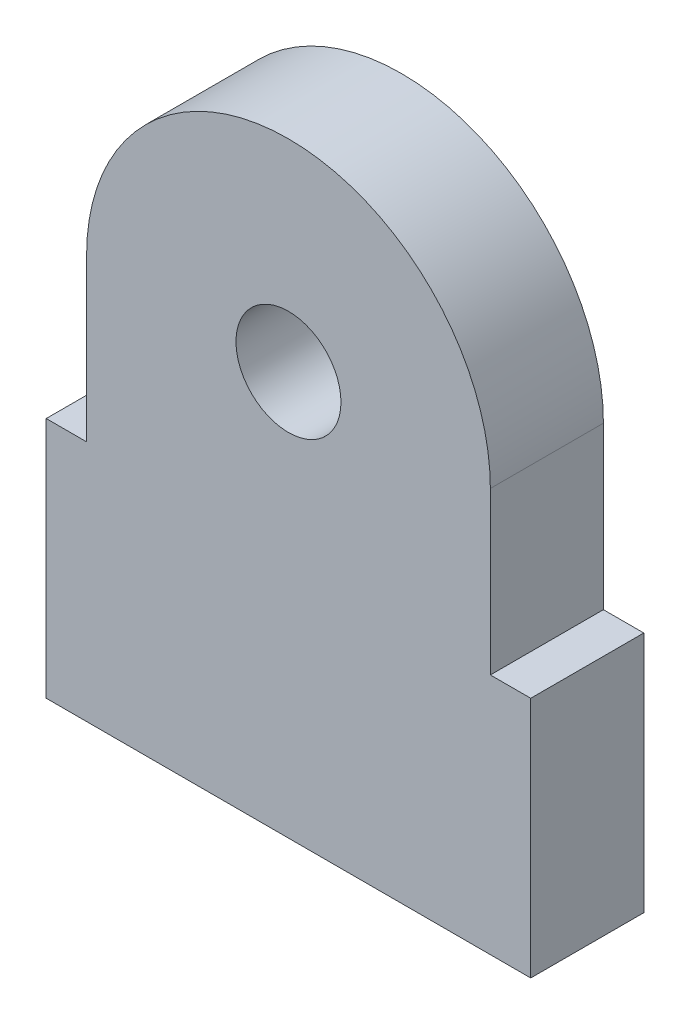
from build123d import *

# Parameters (mm, degrees)
Y_KSEKLIK_EKSTR_ZYON1_DEPTH = 7
IZIM4_R                     = 3.25
KES_EKSTR_ZYON1_DEPTH       = 30.983328701


with BuildPart() as part:
    # Çizim1 → Yükseklik-Ekstrüzyon1 (new body)
    with BuildSketch(Plane.XY):
        with BuildLine():
            Line((-12.5, 0), (-12.5, -10))
            Line((-12.5, -10), (-15, -10))
            Line((-15, -10), (-15, -25))
            Line((-15, -25), (15, -25))
            Line((15, -25), (15, -10))
            Line((15, -10), (12.5, -10))
            Line((12.5, -10), (12.5, 0))
            ThreePointArc((12.5, 0), (0, 12.5), (-12.5, 0))
        make_face()
    extrude(amount=Y_KSEKLIK_EKSTR_ZYON1_DEPTH)

    # Çizim4 → Kes-Ekstrüzyon1 (cut, through all)
    with BuildSketch(Plane.XY.offset(7)):
        Circle(IZIM4_R)
    extrude(amount=-KES_EKSTR_ZYON1_DEPTH, mode=Mode.SUBTRACT)


solid = part.part
